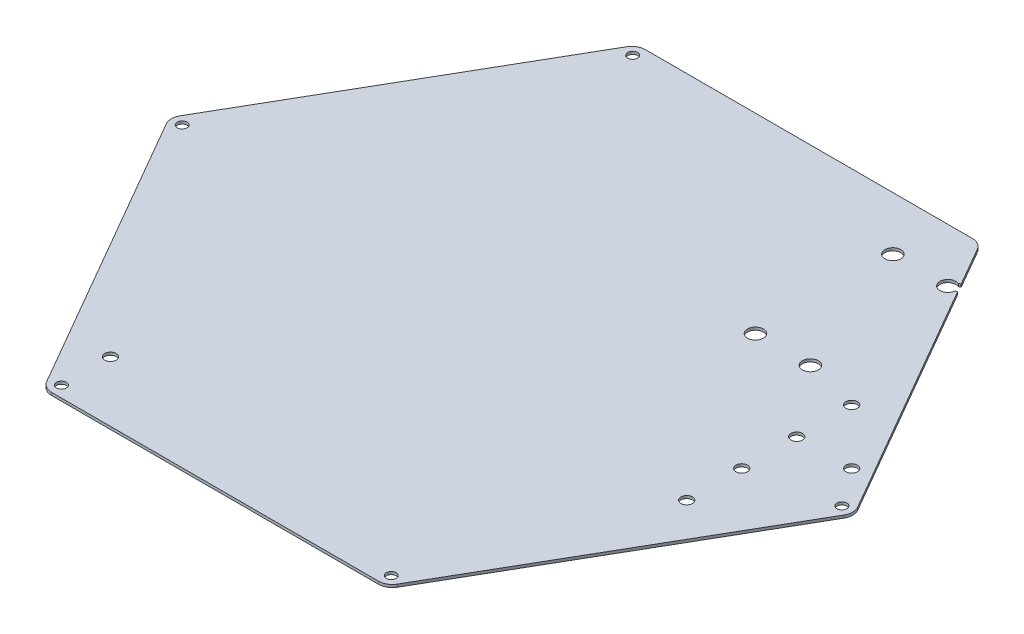
from build123d import *

# Parameters (mm, degrees)
BOSS_EXTRUDE1_DEPTH      = 1
FILLET1_R                = 5
M5_CLEARANCE_HOLE1_D     = 5.8
M5_CLEARANCE_HOLE1_DEPTH = 5
M5_CLEARANCE_HOLE1_TIP   = 1.742495795
M3_CLEARANCE_HOLE1_D     = 3.6
CUT_EXTRUDE1_DEPTH       = 330.362644314
SKETCH10_R               = 2.1
CUT_EXTRUDE2_DEPTH       = 330.362644314


with BuildPart() as part:
    # Sketch1 → Boss-Extrude1 (new body)
    with BuildSketch(Plane(origin=(0, 0, 0), x_dir=(1, 0, 0), z_dir=(0, 1, 0))):
        Polygon((62.353829072, 0), (187.061487217, 0), (249.41531629, 108), (187.061487217, 216), (62.353829072, 216), (0, 108), align=None)
    extrude(amount=BOSS_EXTRUDE1_DEPTH)

    # Fillet1
    fillet1_edges = [part.edges().sort_by_distance(p)[0] for p in [
        (0, 0.5, -108),
        (62.353829072, 0.5, -216),
        (187.061487217, 0.5, -216),
        (249.41531629, 0.5, -108),
        (187.061487217, 0.5, 0),
        (62.353829072, 0.5, 0),
    ]]
    fillet(fillet1_edges, radius=FILLET1_R)

    # M5 Clearance Hole1
    with Locations(Plane(origin=(0, 1, 0), x_dir=(1, 0, 0), z_dir=(0, 1, 0))):
        with Locations((174.707658145, 146.57), (194.707658145, 146.57), (194.707658145, 196.57), (174.707658145, 196.57)):
            Hole(M5_CLEARANCE_HOLE1_D / 2, depth=M5_CLEARANCE_HOLE1_DEPTH)
            with Locations((0, 0, -(M5_CLEARANCE_HOLE1_DEPTH + M5_CLEARANCE_HOLE1_TIP / 2))):  # 118° drill point
                Cone(0, M5_CLEARANCE_HOLE1_D / 2, M5_CLEARANCE_HOLE1_TIP, mode=Mode.SUBTRACT)

    # M3 Clearance Hole1 (through all)
    with Locations(Plane(origin=(0, 1, 0), x_dir=(1, 0, 0), z_dir=(0, 1, 0))):
        with Locations((4.707658145, 108), (64.707658145, 211.923048454), (244.707658145, 108), (184.707658145, 4.076951546), (64.707658145, 4.076951546)):
            Hole(M3_CLEARANCE_HOLE1_D / 2)

    # Sketch9 → Cut-Extrude1 (cut, through all)
    with BuildSketch(Plane(origin=(0, 1, 0), x_dir=(1, 0, 0), z_dir=(0, 1, 0))):
        Polygon((195.835312633, 199.241777565), (196.511466747, 199.632155324), (198.261466747, 196.601066411), (197.585312633, 196.210688651), align=None)
    extrude(amount=-CUT_EXTRUDE1_DEPTH, mode=Mode.SUBTRACT)

    # Sketch10 → Cut-Extrude2 (cut, through all)
    with BuildSketch(Plane(origin=(0, 1, 0), x_dir=(1, 0, 0), z_dir=(0, 1, 0))):
        with Locations(Location((64.707658145, 21.923048454, 0), (0, 0, 270))):
            Circle(SKETCH10_R)
        with Locations(Location((214.707658145, 141.57, 0), (0, 0, 270))):
            Circle(SKETCH10_R)
        with Locations(Location((214.707658145, 121.57, 0), (0, 0, 270))):
            Circle(SKETCH10_R)
        with Locations(Location((214.707658145, 101.57, 0), (0, 0, 270))):
            Circle(SKETCH10_R)
        with Locations(Location((214.707658145, 81.57, 0), (0, 0, 270))):
            Circle(SKETCH10_R)
        with Locations(Location((234.707658145, 121.57, 0), (0, 0, 270))):
            Circle(SKETCH10_R)
    extrude(amount=-CUT_EXTRUDE2_DEPTH, mode=Mode.SUBTRACT)


solid = part.part
